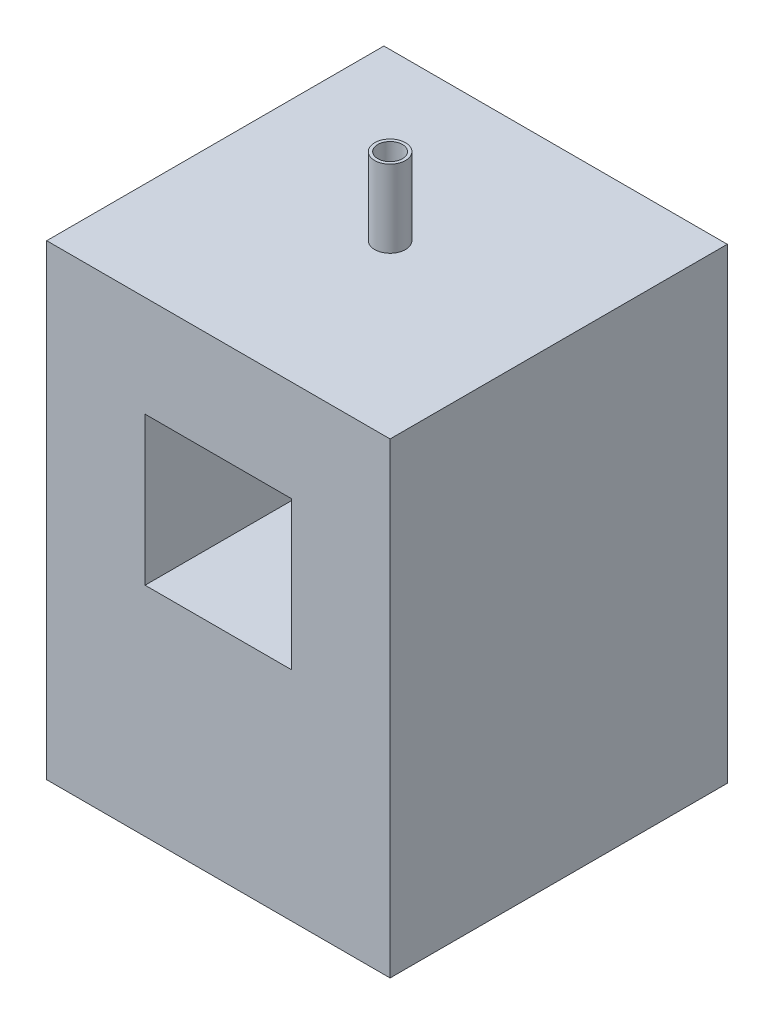
from build123d import *

# Parameters (mm, degrees)
SKETCH1_W                 = 282.575
SKETCH1_H                 = 384.175
CELL_BODY_DEPTH           = 277.495
SKETCH5_W                 = 120.65
SKETCH5_H                 = 121.92
SEE_THROUGH_HOLE_DEPTH    = 282.575
SKETCH6_R                 = 12.7
CHIMNEY_DEPTH             = 63.5
SKETCH9_R                 = 10.16
CHIMNEY_COUNTERBORE_DEPTH = 50.8
SKETCH10_R                = 5.566584011
CHIMNEY_HOLE_DEPTH        = 98.806


with BuildPart() as part:
    # Sketch1 → Cell body (new body)
    with BuildSketch(Plane.XY):
        Rectangle(SKETCH1_W, SKETCH1_H)
    extrude(amount=-CELL_BODY_DEPTH)

    # Sketch5 → see-through hole (cut)
    with BuildSketch(Plane.XY):
        with Locations((0, 47.989561969)):
            Rectangle(SKETCH5_W, SKETCH5_H)
    extrude(amount=-SEE_THROUGH_HOLE_DEPTH, mode=Mode.SUBTRACT)

    # Sketch6 → Chimney (add)
    with BuildSketch(Plane(origin=(0, 192.0875, 0), x_dir=(1, 0, 0), z_dir=(0, 1, 0))):
        with Locations(Location((0, 141.2875, 0), (0, 0, 270))):
            Circle(SKETCH6_R)
    extrude(amount=CHIMNEY_DEPTH)

    # Sketch9 → Chimney counterbore (cut)
    with BuildSketch(Plane(origin=(0, 255.5875, 0), x_dir=(1, 0, 0), z_dir=(0, 1, 0))):
        with Locations(Location((0, 141.2875, 0), (0, 0, 270))):
            Circle(SKETCH9_R)
    extrude(amount=-CHIMNEY_COUNTERBORE_DEPTH, mode=Mode.SUBTRACT)

    # Sketch10 → Chimney hole (cut)
    with BuildSketch(Plane(origin=(0, 204.7875, 0), x_dir=(1, 0, 0), z_dir=(0, 1, 0))):
        with Locations(Location((0, 141.2875, 0), (0, 0, 270))):
            Circle(SKETCH10_R)
    extrude(amount=-CHIMNEY_HOLE_DEPTH, mode=Mode.SUBTRACT)


solid = part.part
